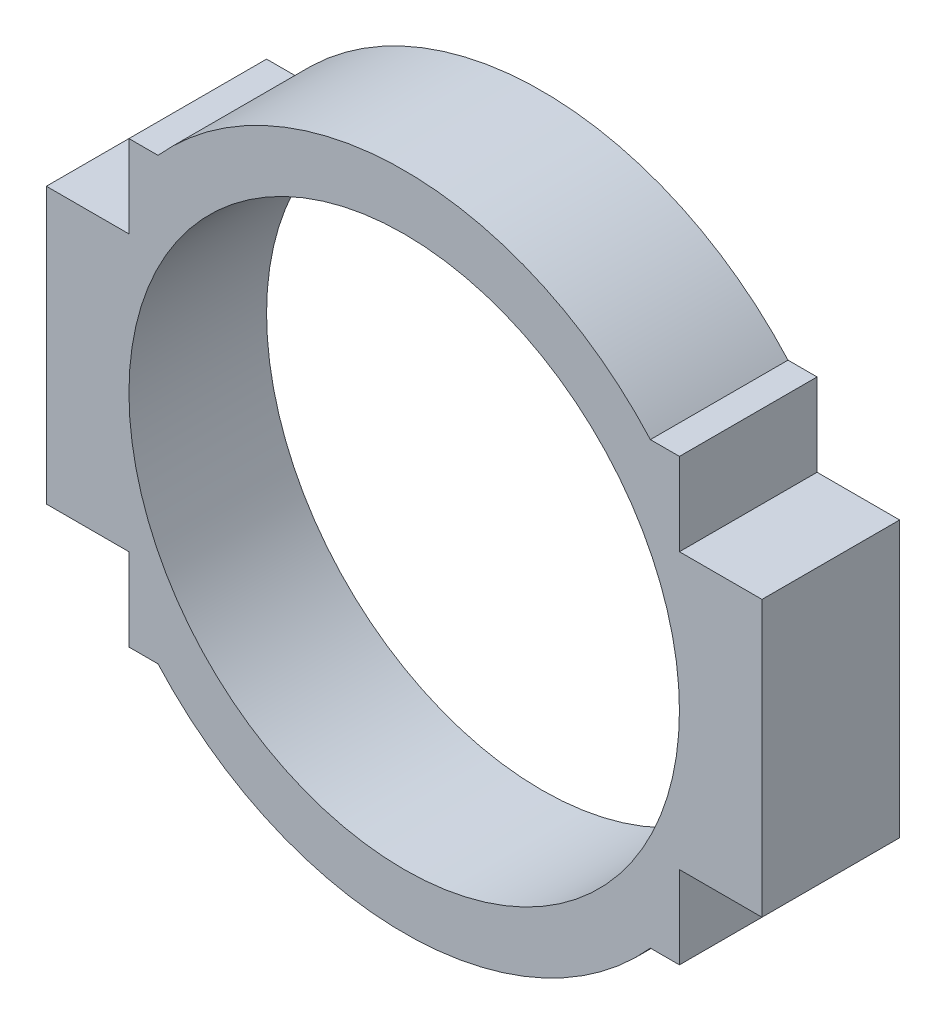
from build123d import *

# Parameters (mm, degrees)
SKETCH_1_R      = 10
EXTRUDE_1_DEPTH = 5


with BuildPart() as part:
    # 草图1 → 凸台-拉伸1 (new body)
    with BuildSketch(Plane.XY):
        with BuildLine():
            Line((13, -5), (10, -5))
            Line((10, -5), (10, -8))
            Line((10, -8), (8.94427191, -8))
            ThreePointArc((8.94427191, -8), (0, -12), (-8.94427191, -8))
            Line((-8.94427191, -8), (-10, -8))
            Line((-10, -8), (-10, -5))
            Line((-10, -5), (-13, -5))
            Line((-13, -5), (-13, 5))
            Line((-13, 5), (-10, 5))
            Line((-10, 5), (-10, 8))
            Line((-10, 8), (-8.94427191, 8))
            ThreePointArc((-8.94427191, 8), (0, 12), (8.94427191, 8))
            Line((8.94427191, 8), (10, 8))
            Line((10, 8), (10, 5))
            Line((10, 5), (13, 5))
            Line((13, 5), (13, -5))
        make_face()
        Circle(SKETCH_1_R, mode=Mode.SUBTRACT)
    extrude(amount=EXTRUDE_1_DEPTH)


solid = part.part
